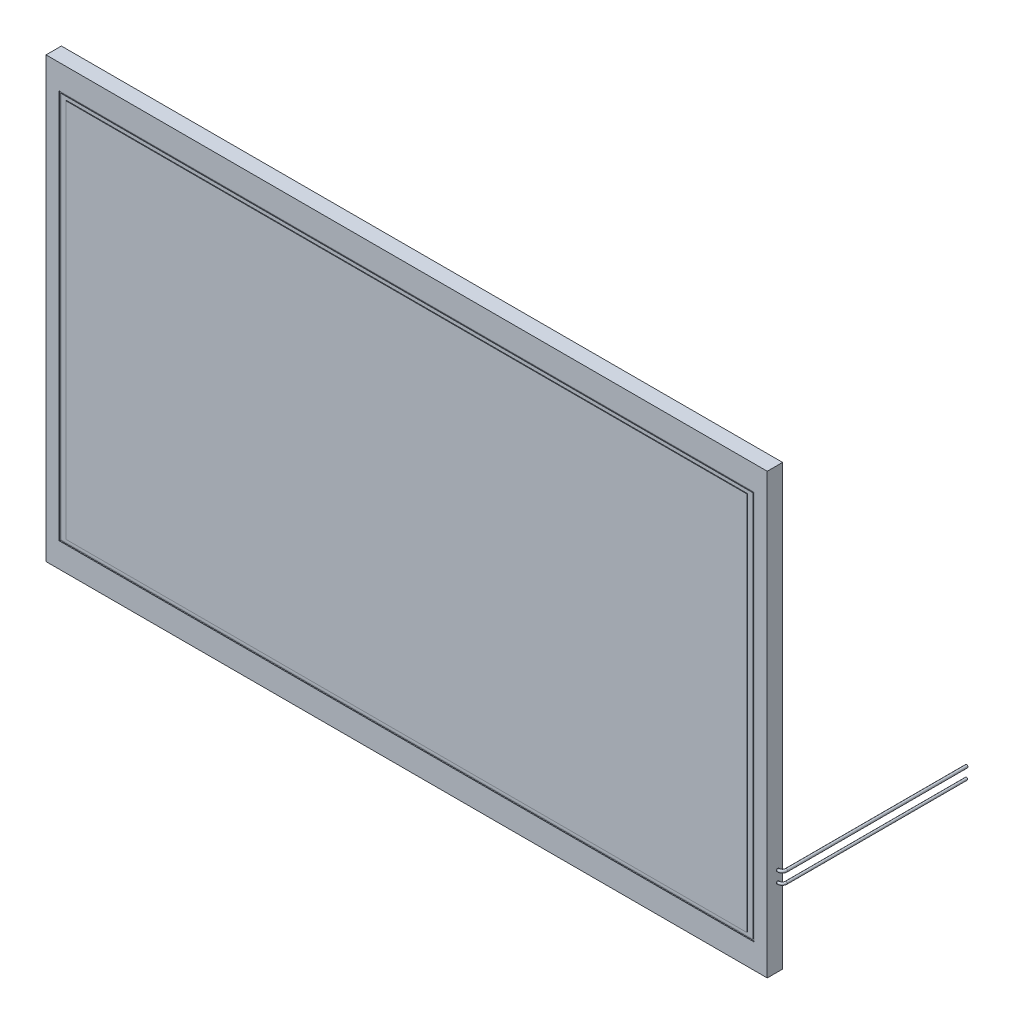
from build123d import *

# Parameters (mm, degrees)
SKETCH1_W                = 235
SKETCH1_H                = 143
BOSS_EXTRUDE1_DEPTH      = 5
SKETCH2_W                = 226.4
SKETCH2_H                = 126.98
CUT_EXTRUDE1_DEPTH       = 0.3
BOSS_EXTRUDE2_START      = -0.3
SKETCH3_W                = 225.4
SKETCH3_H                = 125.98
SKETCH3_W_2              = 221.9
SKETCH3_H_2              = 123.76
BOSS_EXTRUDE2_DEPTH      = 0.2
BOSS_EXTRUDE3_START      = 0.2
SKETCH4_W                = 221.9
SKETCH4_H                = 123.76
BOSS_EXTRUDE3_DEPTH      = 0.2
BOSS_EXTRUDE4_DEPTH      = 19.63
BOSS_EXTRUDE4_DEPTH_BACK = 18.67
CUT_EXTRUDE2_DEPTH       = 4.2
SKETCH9_W                = 25.5
SKETCH9_H                = 6
BOSS_EXTRUDE5_DEPTH      = 0.3
SKETCH8_W                = 0.3
SKETCH8_H                = 3.8
CUT_EXTRUDE3_DEPTH       = 0.01
BOSS_EXTRUDE7_START      = -42.256
BOSS_EXTRUDE7_DEPTH      = 12.256
CUT_EXTRUDE4_REACH       = 200.684
SWEEP1_PROFILE_R         = 0.4
SWEEP7_PROFILE_R         = 0.45


with BuildPart() as part:
    # Sketch1 → Boss-Extrude1 (new body)
    with BuildSketch(Plane.XY):
        Rectangle(SKETCH1_W, SKETCH1_H)
    extrude(amount=-BOSS_EXTRUDE1_DEPTH)

    # Sketch2 → Cut-Extrude1 (cut)
    with BuildSketch(Plane.XY):
        Rectangle(SKETCH2_W, SKETCH2_H)
    extrude(amount=-CUT_EXTRUDE1_DEPTH, mode=Mode.SUBTRACT)



with BuildPart() as body_2:
    # Sketch3 → Boss-Extrude2 (new body)
    with BuildSketch(Plane.XY.offset(BOSS_EXTRUDE2_START)):
        Rectangle(SKETCH3_W, SKETCH3_H)
        Rectangle(SKETCH3_W_2, SKETCH3_H_2, mode=Mode.SUBTRACT)
    extrude(amount=BOSS_EXTRUDE2_DEPTH)


with BuildPart() as part_1:
    add(part.part)

    add(body_2.part)  # Boss-Extrude3 merges body 2
    # Sketch4 → Boss-Extrude3 (add)
    with BuildSketch(Plane.XY.offset(-0.3).offset(BOSS_EXTRUDE3_START)):
        Rectangle(SKETCH4_W, SKETCH4_H)
    extrude(amount=BOSS_EXTRUDE3_DEPTH)

    # Sketch5 → Boss-Extrude4 (add, two sides: drawn at the far end of the back side and taken through both)
    with BuildSketch(Plane(origin=(0, 0, 0), x_dir=(0, 0, -1), z_dir=(1, 0, 0)).offset(-BOSS_EXTRUDE4_DEPTH_BACK)):
        with BuildLine():
            Line((1.2, -71.5), (1.2, -72))
            ThreePointArc((1.2, -72), (1.492893219, -72.707106781), (2.2, -73))
            Line((2.2, -73), (69.2, -73))
            Line((69.2, -73), (69.2, -72.9))
            Line((69.2, -72.9), (2.2, -72.9))
            ThreePointArc((2.2, -72.9), (1.563603897, -72.636396103), (1.3, -72))
            Line((1.3, -72), (1.3, -71.5))
            Line((1.3, -71.5), (1.2, -71.5))
        make_face()
    extrude(amount=BOSS_EXTRUDE4_DEPTH + BOSS_EXTRUDE4_DEPTH_BACK)

    # Sketch7 → Cut-Extrude2 (cut)
    with BuildSketch(Plane.XZ.offset(73)):
        Polygon((-18.67, -29.3), (-12.27, -36.43), (-12.27, -69.2), (-18.67, -69.2), align=None)
        Polygon((19.63, -69.2), (19.63, -29.3), (13.23, -36.43), (13.23, -69.2), align=None)
    extrude(amount=-CUT_EXTRUDE2_DEPTH, mode=Mode.SUBTRACT)

    # Sketch9 → Boss-Extrude5 (add)
    with BuildSketch(Plane.XZ.offset(73)):
        with Locations((0.48, -66.2)):
            Rectangle(SKETCH9_W, SKETCH9_H)
    extrude(amount=-BOSS_EXTRUDE5_DEPTH)

    # Sketch8 → Cut-Extrude3 (cut)
    with BuildSketch(Plane.XZ.offset(73)):
        with Locations((-11.77, -67.3)):
            Rectangle(SKETCH8_W, SKETCH8_H)
        with Locations((-11.27, -67.3)):
            Rectangle(SKETCH8_W, SKETCH8_H)
        with Locations((-10.77, -67.3)):
            Rectangle(SKETCH8_W, SKETCH8_H)
        with Locations((-10.27, -67.3)):
            Rectangle(SKETCH8_W, SKETCH8_H)
        with Locations((-9.77, -67.3)):
            Rectangle(SKETCH8_W, SKETCH8_H)
        with Locations((-9.27, -67.3)):
            Rectangle(SKETCH8_W, SKETCH8_H)
        with Locations((-8.77, -67.3)):
            Rectangle(SKETCH8_W, SKETCH8_H)
        with Locations((-8.27, -67.3)):
            Rectangle(SKETCH8_W, SKETCH8_H)
        with Locations((-7.77, -67.3)):
            Rectangle(SKETCH8_W, SKETCH8_H)
        with Locations((-7.27, -67.3)):
            Rectangle(SKETCH8_W, SKETCH8_H)
        with Locations((-6.77, -67.3)):
            Rectangle(SKETCH8_W, SKETCH8_H)
        with Locations((-6.27, -67.3)):
            Rectangle(SKETCH8_W, SKETCH8_H)
        with Locations((-5.77, -67.3)):
            Rectangle(SKETCH8_W, SKETCH8_H)
        with Locations((-5.27, -67.3)):
            Rectangle(SKETCH8_W, SKETCH8_H)
        with Locations((-4.77, -67.3)):
            Rectangle(SKETCH8_W, SKETCH8_H)
        with Locations((-4.27, -67.3)):
            Rectangle(SKETCH8_W, SKETCH8_H)
        with Locations((-3.77, -67.3)):
            Rectangle(SKETCH8_W, SKETCH8_H)
        with Locations((-3.27, -67.3)):
            Rectangle(SKETCH8_W, SKETCH8_H)
        with Locations((-2.77, -67.3)):
            Rectangle(SKETCH8_W, SKETCH8_H)
        with Locations((-2.27, -67.3)):
            Rectangle(SKETCH8_W, SKETCH8_H)
        with Locations((-1.77, -67.3)):
            Rectangle(SKETCH8_W, SKETCH8_H)
        with Locations((-1.27, -67.3)):
            Rectangle(SKETCH8_W, SKETCH8_H)
        with Locations((-0.77, -67.3)):
            Rectangle(SKETCH8_W, SKETCH8_H)
        with Locations((-0.27, -67.3)):
            Rectangle(SKETCH8_W, SKETCH8_H)
        with Locations((0.23, -67.3)):
            Rectangle(SKETCH8_W, SKETCH8_H)
        with Locations((0.73, -67.3)):
            Rectangle(SKETCH8_W, SKETCH8_H)
        with Locations((1.23, -67.3)):
            Rectangle(SKETCH8_W, SKETCH8_H)
        with Locations((1.73, -67.3)):
            Rectangle(SKETCH8_W, SKETCH8_H)
        with Locations((2.23, -67.3)):
            Rectangle(SKETCH8_W, SKETCH8_H)
        with Locations((2.73, -67.3)):
            Rectangle(SKETCH8_W, SKETCH8_H)
        with Locations((3.23, -67.3)):
            Rectangle(SKETCH8_W, SKETCH8_H)
        with Locations((3.73, -67.3)):
            Rectangle(SKETCH8_W, SKETCH8_H)
        with Locations((4.23, -67.3)):
            Rectangle(SKETCH8_W, SKETCH8_H)
        with Locations((4.73, -67.3)):
            Rectangle(SKETCH8_W, SKETCH8_H)
        with Locations((5.23, -67.3)):
            Rectangle(SKETCH8_W, SKETCH8_H)
        with Locations((5.73, -67.3)):
            Rectangle(SKETCH8_W, SKETCH8_H)
        with Locations((6.23, -67.3)):
            Rectangle(SKETCH8_W, SKETCH8_H)
        with Locations((6.73, -67.3)):
            Rectangle(SKETCH8_W, SKETCH8_H)
        with Locations((7.23, -67.3)):
            Rectangle(SKETCH8_W, SKETCH8_H)
        with Locations((7.73, -67.3)):
            Rectangle(SKETCH8_W, SKETCH8_H)
        with Locations((8.23, -67.3)):
            Rectangle(SKETCH8_W, SKETCH8_H)
        with Locations((8.73, -67.3)):
            Rectangle(SKETCH8_W, SKETCH8_H)
        with Locations((9.23, -67.3)):
            Rectangle(SKETCH8_W, SKETCH8_H)
        with Locations((9.73, -67.3)):
            Rectangle(SKETCH8_W, SKETCH8_H)
        with Locations((10.23, -67.3)):
            Rectangle(SKETCH8_W, SKETCH8_H)
        with Locations((10.73, -67.3)):
            Rectangle(SKETCH8_W, SKETCH8_H)
        with Locations((11.23, -67.3)):
            Rectangle(SKETCH8_W, SKETCH8_H)
        with Locations((11.73, -67.3)):
            Rectangle(SKETCH8_W, SKETCH8_H)
        with Locations((12.23, -67.3)):
            Rectangle(SKETCH8_W, SKETCH8_H)
        with Locations((12.73, -67.3)):
            Rectangle(SKETCH8_W, SKETCH8_H)
    extrude(amount=-CUT_EXTRUDE3_DEPTH, mode=Mode.SUBTRACT)

    # Sketch10 → Boss-Extrude7 (add)
    with BuildSketch(Plane(origin=(0, 0, 0), x_dir=(0, 0, -1), z_dir=(1, 0, 0)).offset(BOSS_EXTRUDE7_START)):
        with BuildLine():
            Line((2.2, -73), (69.2, -73))
            Line((69.2, -73), (69.2, -72.9))
            Line((69.2, -72.9), (2.2, -72.9))
            ThreePointArc((2.2, -72.9), (1.563603897, -72.636396103), (1.3, -72))
            Line((1.3, -72), (1.3, -71.5))
            Line((1.3, -71.5), (1.2, -71.5))
            Line((1.2, -71.5), (1.2, -72))
            ThreePointArc((1.2, -72), (1.492893219, -72.707106781), (2.2, -73))
        make_face()
    extrude(amount=BOSS_EXTRUDE7_DEPTH)

    # Sketch11 → Cut-Extrude4 (cut, up to next)
    with BuildSketch(Plane.XZ.offset(73), mode=Mode.PRIVATE) as cut_extrude4_sk1:
        with BuildLine():
            Line((-39.056, -5.2), (-39.056, -69.2))
            Line((-39.056, -69.2), (-42.256, -69.2))
            Line((-42.256, -69.2), (-42.256, -3.7))
            Line((-42.256, -3.7), (-40.556, -3.7))
            ThreePointArc((-40.556, -3.7), (-39.495339828, -4.139339828), (-39.056, -5.2))
        make_face()
    cut_extrude4_tool1 = extrude(cut_extrude4_sk1.sketch, amount=-CUT_EXTRUDE4_REACH, mode=Mode.PRIVATE) & part_1.part
    # Sketch11 → Cut-Extrude4 (cut, up to next)
    with BuildSketch(Plane.XZ.offset(73), mode=Mode.PRIVATE) as cut_extrude4_sk2:
        with BuildLine():
            Line((-30, -3.7), (-31.7, -3.7))
            ThreePointArc((-31.7, -3.7), (-32.760660172, -4.139339828), (-33.2, -5.2))
            Line((-33.2, -5.2), (-33.2, -69.2))
            Line((-33.2, -69.2), (-30, -69.2))
            Line((-30, -69.2), (-30, -3.7))
        make_face()
    cut_extrude4_tool2 = extrude(cut_extrude4_sk2.sketch, amount=-CUT_EXTRUDE4_REACH, mode=Mode.PRIVATE) & part_1.part
    add(cut_extrude4_tool1.solids().sort_by_distance((-40.658921, -73, -36.524847))[0], mode=Mode.SUBTRACT)
    add(cut_extrude4_tool2.solids().sort_by_distance((-31.597079, -73, -36.524847))[0], mode=Mode.SUBTRACT)

    # Sweep1: sweep along a curve in space
    with BuildLine() as sweep1_path:
        Line((117.5, -46.2, -3.4), (117.75, -46.2, -3.4))
        ThreePointArc((117.75, -46.2, -3.4), (118.633883476, -46.2, -3.766116524), (119, -46.2, -4.65))
        Line((119, -46.2, -4.65), (119, -46.2, -63.4))
    # Sweep1 profile (on start of the path) → Sweep1 (sweep)
    with BuildSketch(Plane(origin=(117.5, -46.2, -3.4), x_dir=(0, 0, 1), z_dir=(1, 0, 0))):
        Circle(SWEEP1_PROFILE_R)
    sweep(path=sweep1_path.line)

    # Sweep7: sweep along a curve in space
    with BuildLine() as sweep7_path:
        Line((117.5, -42.700357161, -3.45), (117.75, -42.700357161, -3.45))
        ThreePointArc((117.75, -42.700357161, -3.45), (118.633883476, -42.700357161, -3.816116524), (119, -42.700357161, -4.7))
        Line((119, -42.700357161, -4.7), (119, -42.700357161, -63.45))
    # Sweep7 profile (on start of the path) → Sweep7 (sweep)
    with BuildSketch(Plane(origin=(117.5, -42.700357161, -3.45), x_dir=(0, 0, 1), z_dir=(1, 0, 0))):
        Circle(SWEEP7_PROFILE_R)
    sweep(path=sweep7_path.line)


solid = part_1.part
